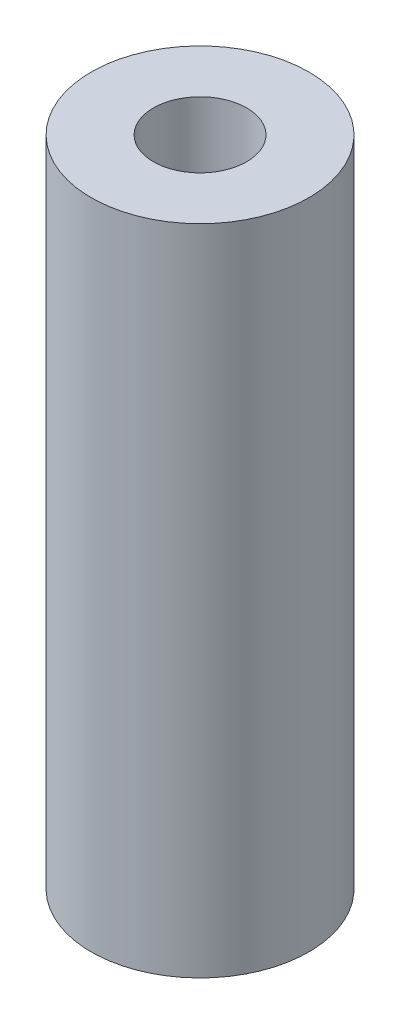
from build123d import *

# Parameters (mm, degrees)
SKETCH1_R           = 3.5
SKETCH1_R_2         = 1.5
BOSS_EXTRUDE1_DEPTH = 21


with BuildPart() as part:
    # Sketch1 → Boss-Extrude1 (new body)
    with BuildSketch(Plane(origin=(0, 0, 0), x_dir=(1, 0, 0), z_dir=(0, 1, 0))):
        with Locations(Location((0, 0, 0), (0, 0, 90))):
            Circle(SKETCH1_R)
        with Locations(Location((0, 0, 0), (0, 0, 90))):
            Circle(SKETCH1_R_2, mode=Mode.SUBTRACT)
    extrude(amount=BOSS_EXTRUDE1_DEPTH)


solid = part.part
